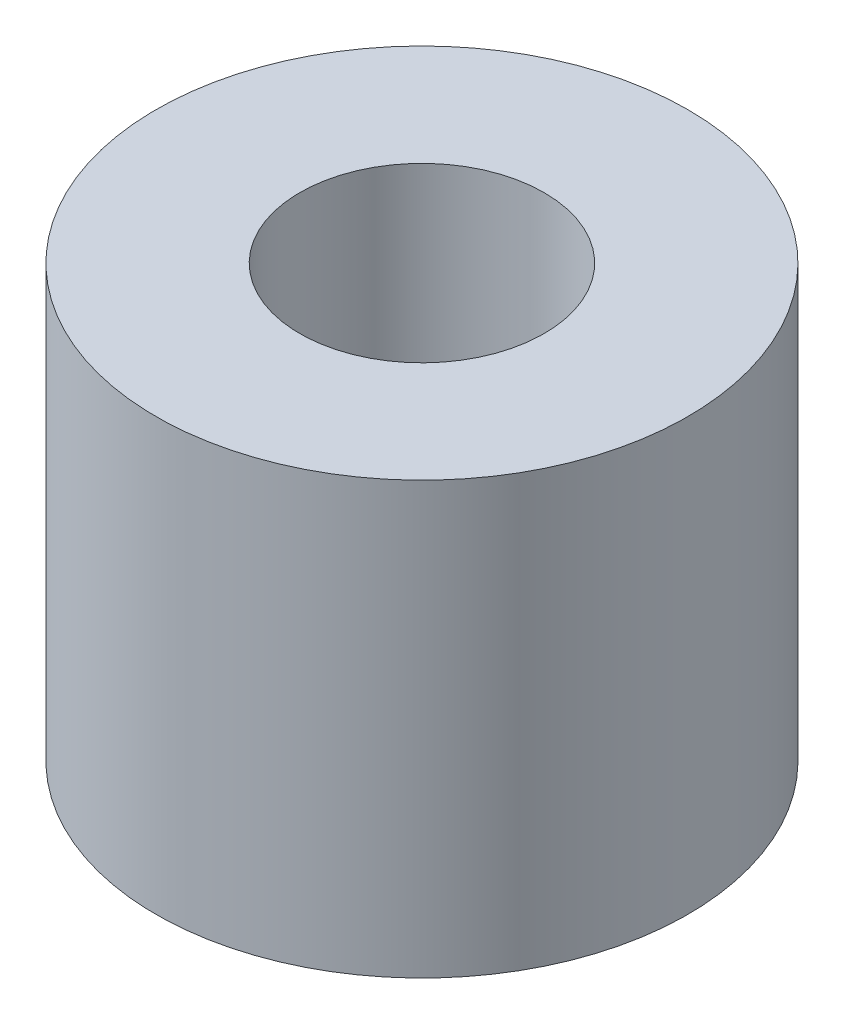
from build123d import *

# Parameters (mm, degrees)
SKETCH1_W = 2
SKETCH1_H = 6


with BuildPart() as part:
    # Sketch1 → Ojal_guia (revolve)
    with BuildSketch(Plane.XY, mode=Mode.PRIVATE) as ojal_guia_sk:
        with Locations((2.7, 0)):
            Rectangle(SKETCH1_W, SKETCH1_H)
    revolve(ojal_guia_sk.sketch.rotate(Axis((0, -7, 0), (0, 1, 0)), 90), axis=Axis((0, -7, 0), (0, 1, 0)))


solid = part.part
